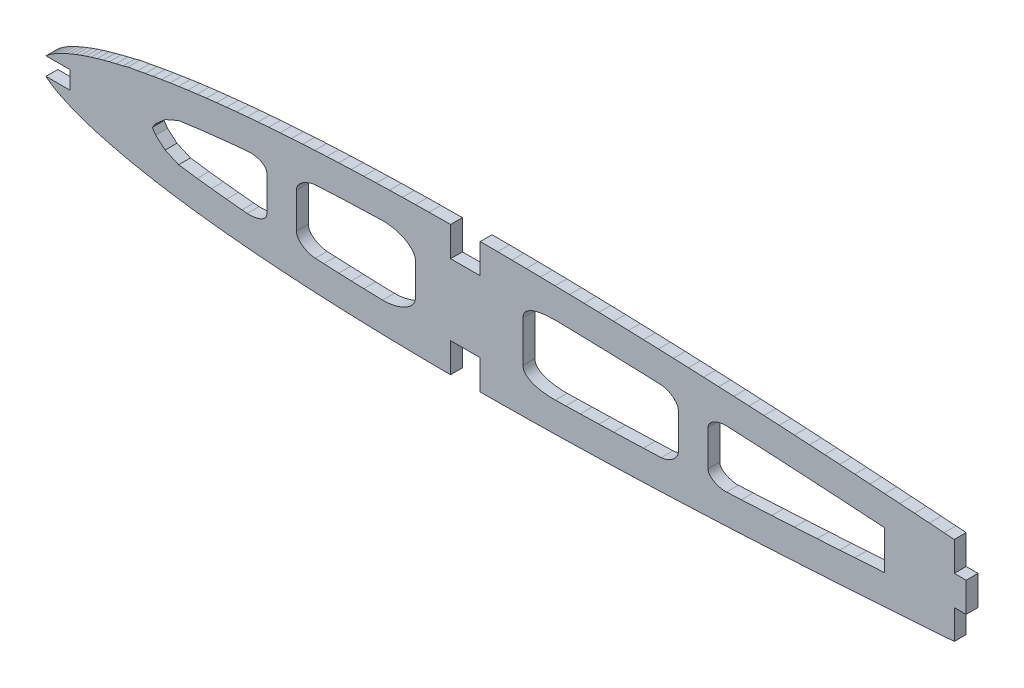
from build123d import *

# Parameters (mm, degrees)
EXTRUDE_1_DEPTH = 2


with BuildPart() as part:
    # Model → 凸台-拉伸1 (new body)
    with BuildSketch(Plane.XY):
        Polygon((365.15593908, -97.397254948), (369.216384424, -97.397254948), (369.216384424, -100.397254948), (365.15593908, -100.397254948), (365.178384424, -100.418254948), (365.561384424, -100.734254948), (365.963384424, -101.027254948), (366.379384424, -101.299254948), (366.925384424, -101.620254948), (367.484384424, -101.915254948), (368.052384424, -102.193254948), (368.758384424, -102.517254948), (369.471384424, -102.823254948), (370.191384424, -103.111254948), (371.050384424, -103.431254948), (371.916384424, -103.729254948), (372.789384424, -104.010254948), (373.800384424, -104.313254948), (374.816384424, -104.598254948), (375.836384424, -104.867254948), (376.993384424, -105.154254948), (378.154384424, -105.425254948), (379.318384424, -105.680254948), (380.617384424, -105.947254948), (381.918384424, -106.198254948), (383.223384424, -106.434254948), (384.657384424, -106.679254948), (386.093384424, -106.909254948), (387.532384424, -107.125254948), (389.097384424, -107.346254948), (390.664384424, -107.552254948), (392.233384424, -107.746254948), (393.923384424, -107.940254948), (395.614384424, -108.121254948), (397.306384424, -108.290254948), (399.113384424, -108.458254948), (400.921384424, -108.614254948), (402.730384424, -108.759254948), (404.647384424, -108.900254948), (406.564384424, -109.029254948), (408.482384424, -109.147254948), (410.502384424, -109.260254948), (412.522384424, -109.361254948), (414.543384424, -109.452254948), (416.657384424, -109.537254948), (418.771384424, -109.612254948), (420.886384424, -109.677254948), (423.086384424, -109.735254948), (425.286384424, -109.783254948), (427.486384424, -109.821254948), (429.765384424, -109.851254948), (433.406384424, -109.880254948), (433.412384424, -104.880254948), (438.412384424, -104.886254948), (438.406384424, -109.886254948), (441.360384424, -109.872254948), (443.766384424, -109.852254948), (446.170384424, -109.823254948), (448.576384424, -109.787254948), (451.031384424, -109.742254948), (453.485384424, -109.690254948), (455.940384424, -109.631254948), (458.436384424, -109.564254948), (460.931384424, -109.491254948), (463.426384424, -109.411254948), (465.952384424, -109.323254948), (468.476384424, -109.230254948), (471.001384424, -109.130254948), (473.547384424, -109.024254948), (476.092384424, -108.913254948), (478.638384424, -108.796254948), (481.194384424, -108.672254948), (483.748384424, -108.543254948), (486.303384424, -108.407254948), (488.858384424, -108.266254948), (491.413384424, -108.120254948), (493.968384424, -107.970254948), (496.514384424, -107.819254948), (499.059384424, -107.665254948), (501.605384424, -107.506254948), (504.131384424, -107.343254948), (506.655384424, -107.175254948), (509.180384424, -107.003254948), (511.676384424, -106.831254948), (514.171384424, -106.655254948), (516.666384424, -106.476254948), (518.390324675, -106.34985607), (518.390324675, -101.397254948), (520.390324675, -101.397254948), (520.390324675, -98.897254948), (520.390324675, -96.397254948), (518.390324675, -96.397254948), (518.390324675, -91.44395161), (516.666384424, -91.318254948), (514.171384424, -91.139254948), (511.676384424, -90.963254948), (509.180384424, -90.790254948), (506.655384424, -90.618254948), (504.131384424, -90.450254948), (501.605384424, -90.287254948), (499.059384424, -90.128254948), (496.514384424, -89.974254948), (493.968384424, -89.823254948), (491.413384424, -89.674254948), (488.858384424, -89.528254948), (486.303384424, -89.386254948), (483.748384424, -89.251254948), (481.194384424, -89.121254948), (478.638384424, -88.998254948), (476.092384424, -88.881254948), (473.547384424, -88.769254948), (471.001384424, -88.663254948), (468.476384424, -88.564254948), (465.952384424, -88.470254948), (463.426384424, -88.383254948), (460.931384424, -88.303254948), (458.436384424, -88.230254948), (455.940384424, -88.163254948), (453.485384424, -88.104254948), (451.031384424, -88.052254948), (448.576384424, -88.007254948), (446.170384424, -87.970254948), (443.766384424, -87.942254948), (441.360384424, -87.921254948), (438.406384424, -87.908254948), (438.410384424, -92.908254948), (433.410384424, -92.914254948), (433.406384424, -87.914254948), (429.765384424, -87.942254948), (427.486384424, -87.972254948), (425.286384424, -88.011254948), (423.086384424, -88.059254948), (420.886384424, -88.117254948), (418.771384424, -88.182254948), (416.657384424, -88.256254948), (414.543384424, -88.341254948), (412.522384424, -88.432254948), (410.502384424, -88.534254948), (408.482384424, -88.646254948), (406.564384424, -88.764254948), (404.647384424, -88.894254948), (402.730384424, -89.035254948), (400.921384424, -89.179254948), (399.113384424, -89.335254948), (397.306384424, -89.503254948), (395.614384424, -89.673254948), (393.923384424, -89.854254948), (392.233384424, -90.048254948), (390.664384424, -90.241254948), (389.097384424, -90.448254948), (387.532384424, -90.668254948), (386.093384424, -90.885254948), (384.657384424, -91.115254948), (383.223384424, -91.359254948), (381.918384424, -91.596254948), (380.617384424, -91.847254948), (379.017376205, -92.111320205), (378.154384424, -92.369254948), (376.993384424, -92.640254948), (375.836384424, -92.927254948), (374.816384424, -93.196254948), (373.800384424, -93.480254948), (372.789384424, -93.784254948), (371.916384424, -94.064254948), (371.050384424, -94.363254948), (370.191384424, -94.682254948), (369.471384424, -94.971254948), (368.758384424, -95.277254948), (368.052384424, -95.600254948), (367.484384424, -95.878254948), (366.925384424, -96.174254948), (366.379384424, -96.494254948), (365.963384424, -96.767254948), (365.561384424, -97.060254948), (365.178384424, -97.376254948), align=None)
        with BuildLine():
            Line((387.532384424, -95.668254948), (390.664384424, -95.241254948))
            Line((390.664384424, -95.241254948), (393.078384424, -94.951254948))
            Line((393.078384424, -94.951254948), (395.614384424, -94.673254948))
            Line((395.614384424, -94.673254948), (398.209884424, -94.419254948))
            Line((398.209884424, -94.419254948), (399.256008395, -94.326660534))
            add(Edge.make_bspline(
                [(399.256008395, -94.326660534), (400.425031433, -94.223188091), (402.407059943, -94.723661574), (402.407059943, -95.897254948)],
                knots=[0, 0, 0, 0, 3.520780123, 3.520780123, 3.520780123, 3.520780123], degree=3))
            Line((402.407059943, -95.897254948), (402.407059943, -101.897254948))
            add(Edge.make_bspline(
                [(399.107567803, -103.454710604), (400.319033115, -103.561939693), (402.407059943, -103.113456526), (402.407059943, -101.897254948)],
                knots=[0, 0, 0, 0, 3.648604734, 3.648604734, 3.648604734, 3.648604734], degree=3))
            Line((399.107567803, -103.454710604), (398.209884424, -103.375254948))
            Line((398.209884424, -103.375254948), (395.614384424, -103.121254948))
            Line((395.614384424, -103.121254948), (393.078384424, -102.843254948))
            Line((393.078384424, -102.843254948), (390.664384424, -102.553254948))
            Line((390.664384424, -102.553254948), (387.532384424, -102.126254948))
            Line((387.532384424, -102.126254948), (385.253151647, -101.124313558))
            Line((385.253151647, -101.124313558), (383.671211695, -99.742297538))
            Line((383.671211695, -99.742297538), (383.077988193, -98.897254948))
            Line((383.077988193, -98.897254948), (383.671211695, -98.052212358))
            Line((383.671211695, -98.052212358), (385.253151647, -96.670196337))
            Line((385.253151647, -96.670196337), (387.532384424, -95.668254948))
        make_face(mode=Mode.SUBTRACT)
        with BuildLine():
            Line((410.750141724, -93.524244431), (412.007899023, -93.458233914))
            Line((412.007899023, -93.458233914), (414.988545957, -93.323355832))
            Line((414.988545957, -93.323355832), (416.657384424, -93.256254948))
            Line((416.657384424, -93.256254948), (418.771384424, -93.182254948))
            Line((418.771384424, -93.182254948), (421.986384424, -93.088254948))
            add(Edge.make_bspline(
                [(421.986384424, -93.088254948), (424.099590721, -93.026469134), (427.486384424, -94.132487735), (427.486384424, -96.246597084)],
                knots=[0, 0, 0, 0, 6.342328047, 6.342328047, 6.342328047, 6.342328047], degree=3))
            Line((427.486384424, -96.246597084), (427.486384424, -101.547954948))
            add(Edge.make_bspline(
                [(421.934277608, -104.704731451), (424.062299307, -104.766950437), (427.486384424, -103.67688603), (427.486384424, -101.547954948)],
                knots=[0, 0, 0, 0, 6.386793248, 6.386793248, 6.386793248, 6.386793248], degree=3))
            Line((421.934277608, -104.704731451), (418.771384424, -104.612254948))
            Line((418.771384424, -104.612254948), (416.657384424, -104.538254948))
            Line((416.657384424, -104.538254948), (414.543384424, -104.453254948))
            Line((414.543384424, -104.453254948), (412.007899023, -104.336275982))
            Line((412.007899023, -104.336275982), (410.590931808, -104.261909696))
            add(Edge.make_bspline(
                [(410.590931808, -104.261909696), (409.270770722, -104.192624059), (407.407059943, -103.219232933), (407.407059943, -101.897254948)],
                knots=[0, 0, 0, 0, 3.965933954, 3.965933954, 3.965933954, 3.965933954], degree=3))
            Line((407.407059943, -101.897254948), (407.407059943, -95.897254948))
            add(Edge.make_bspline(
                [(410.750141724, -93.524244431), (409.385459952, -93.595866634), (407.407059943, -94.530695005), (407.407059943, -95.897254948)],
                knots=[0, 0, 0, 0, 4.099679829, 4.099679829, 4.099679829, 4.099679829], degree=3))
        make_face(mode=Mode.SUBTRACT)
        with BuildLine():
            Line((451.320064617, -93.060127348), (452.836244811, -93.090499748))
            Line((452.836244811, -93.090499748), (455.299671222, -93.147856952))
            Line((455.299671222, -93.147856952), (458.436384424, -93.230254948))
            Line((458.436384424, -93.230254948), (460.931384424, -93.303254948))
            Line((460.931384424, -93.303254948), (465.952384424, -93.470254948))
            Line((465.952384424, -93.470254948), (468.858180977, -93.580378229))
            add(Edge.make_bspline(
                [(468.858180977, -93.580378229), (470.115446563, -93.628025822), (471.837940312, -94.639086816), (471.837940312, -95.897254948)],
                knots=[0, 0, 0, 0, 3.774504395, 3.774504395, 3.774504395, 3.774504395], degree=3))
            Line((471.837940312, -95.897254948), (471.837940312, -101.897254948))
            add(Edge.make_bspline(
                [(468.955890911, -104.210428675), (470.186852362, -104.163777951), (471.837940312, -103.129100061), (471.837940312, -101.897254948)],
                knots=[0, 0, 0, 0, 3.695535339, 3.695535339, 3.695535339, 3.695535339], degree=3))
            Line((468.955890911, -104.210428675), (465.952384424, -104.324254948))
            Line((465.952384424, -104.324254948), (460.931384424, -104.491254948))
            Line((460.931384424, -104.491254948), (458.436384424, -104.564254948))
            Line((458.436384424, -104.564254948), (455.299671222, -104.646652943))
            Line((455.299671222, -104.646652943), (452.836244811, -104.704010147))
            Line((452.836244811, -104.704010147), (451.086109909, -104.739069171))
            add(Edge.make_bspline(
                [(445.634956017, -102.380454948), (445.634956017, -104.360301738), (449.106660244, -104.778721871), (451.086109909, -104.739069171)],
                knots=[0, 0, 0, 0, 5.93954037, 5.93954037, 5.93954037, 5.93954037], degree=3))
            Line((445.634956017, -102.380454948), (445.634956017, -95.414080797))
            add(Edge.make_bspline(
                [(445.634956017, -95.414080797), (445.634956017, -93.363022625), (449.269417854, -93.019048415), (451.320064617, -93.060127348)],
                knots=[0, 0, 0, 0, 6.153174517, 6.153174517, 6.153174517, 6.153174517], degree=3))
        make_face(mode=Mode.SUBTRACT)
        with BuildLine():
            Line((479.918384424, -94.063004948), (482.471384424, -94.186254948))
            Line((482.471384424, -94.186254948), (487.580884424, -94.457254948))
            Line((487.580884424, -94.457254948), (491.413384424, -94.674254948))
            Line((491.413384424, -94.674254948), (495.241384424, -94.898754948))
            Line((495.241384424, -94.898754948), (499.059384424, -95.128254948))
            Line((499.059384424, -95.128254948), (501.605384424, -95.287254948))
            Line((501.605384424, -95.287254948), (506.655384424, -95.618254948))
            Line((506.655384424, -95.618254948), (506.655384424, -102.176254948))
            Line((506.655384424, -102.176254948), (501.605384424, -102.507254948))
            Line((501.605384424, -102.507254948), (499.059384424, -102.666254948))
            Line((499.059384424, -102.666254948), (495.241384424, -102.895754948))
            Line((495.241384424, -102.895754948), (491.413384424, -103.120254948))
            Line((491.413384424, -103.120254948), (487.580884424, -103.337254948))
            Line((487.580884424, -103.337254948), (482.471384424, -103.608254948))
            Line((482.471384424, -103.608254948), (479.965627503, -103.729224215))
            add(Edge.make_bspline(
                [(479.965627503, -103.729224215), (478.758795619, -103.78748588), (476.837940312, -103.105492349), (476.837940312, -101.897254948)],
                knots=[0, 0, 0, 0, 3.624712204, 3.624712204, 3.624712204, 3.624712204], degree=3))
            Line((476.837940312, -101.897254948), (476.837940312, -95.897254948))
            add(Edge.make_bspline(
                [(479.918384424, -94.063004948), (478.724710277, -94.005378493), (476.837940312, -94.702190608), (476.837940312, -95.897254948)],
                knots=[0, 0, 0, 0, 3.58519302, 3.58519302, 3.58519302, 3.58519302], degree=3))
        make_face(mode=Mode.SUBTRACT)
    extrude(amount=EXTRUDE_1_DEPTH)


solid = part.part
